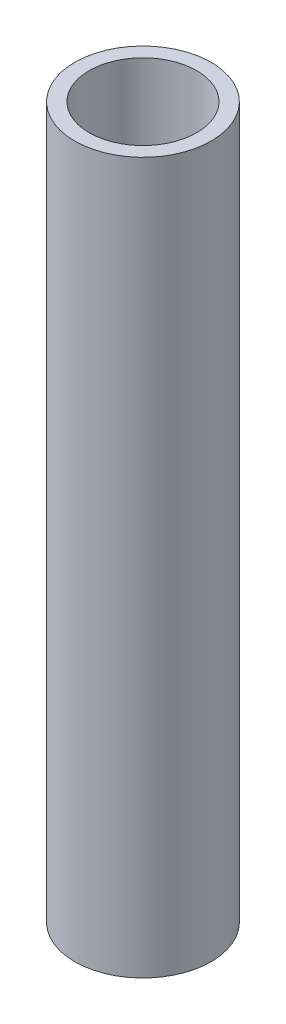
from build123d import *

# Parameters (mm, degrees)
IZIM1_R                     = 3.55
IZIM1_R_2                   = 2.8
Y_KSEKLIK_EKSTR_ZYON1_DEPTH = 37


with BuildPart() as part:
    # Çizim1 → Yükseklik-Ekstrüzyon1 (new body)
    with BuildSketch(Plane(origin=(0, 0, 0), x_dir=(1, 0, 0), z_dir=(0, 1, 0))):
        with Locations(Location((0, 0, 0), (0, 0, 270))):
            Circle(IZIM1_R)
        with Locations(Location((0, 0, 0), (0, 0, 270))):
            Circle(IZIM1_R_2, mode=Mode.SUBTRACT)
    extrude(amount=Y_KSEKLIK_EKSTR_ZYON1_DEPTH)


solid = part.part
